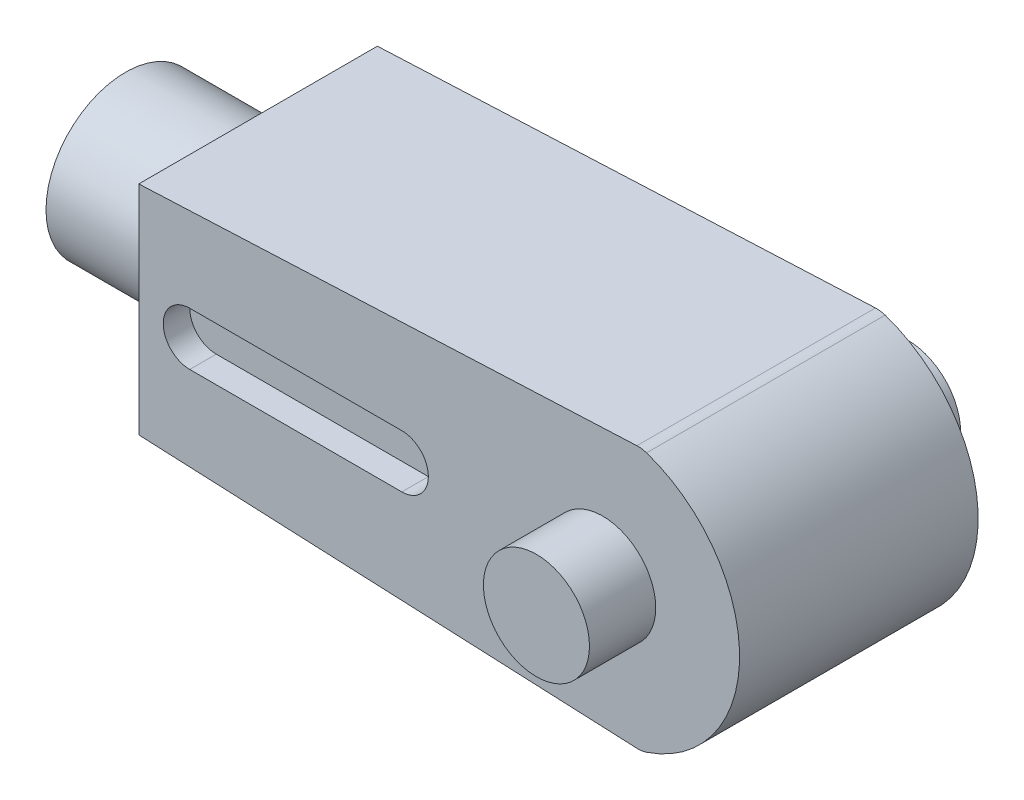
from build123d import *

# Parameters (mm, degrees)
SKETCH2_R                = 20
BOSS_EXTRUDE1_DEPTH      = 45
SKETCH3_R                = 30
BOSS_EXTRUDE2_DEPTH      = 50
BOSS_EXTRUDE3_DEPTH      = 25
BOSS_EXTRUDE3_DEPTH_BACK = 115
SKETCH4_R                = 20
CUT_EXTRUDE1_DEPTH       = 10


with BuildPart() as part:
    # Sketch2 → Boss-Extrude1 (new, symmetric)
    with BuildSketch(Plane.XY):
        with BuildLine():
            Line((-80.985865724, 41), (-80.985865724, -41))
            Line((-80.985865724, -41), (106.905960483, -49.424273902))
            ThreePointArc((106.905960483, -49.424273902), (108.756170043, -49.335499296), (110.558264434, -48.906999406))
            ThreePointArc((110.558264434, -48.906999406), (145.643610678, 0), (110.558264434, 48.906999406))
            ThreePointArc((110.558264434, 48.906999406), (108.756170043, 49.335499296), (106.905960483, 49.424273902))
            Line((106.905960483, 49.424273902), (-80.985865724, 41))
        make_face()
        with Locations(Location((94.014134276, 0, 0), (0, 0, 180))):
            Circle(SKETCH2_R, mode=Mode.SUBTRACT)
    extrude(amount=BOSS_EXTRUDE1_DEPTH, both=True)

    # Sketch3 → Boss-Extrude2 (add)
    with BuildSketch(Plane.ZY.offset(80.985865724)):
        Circle(SKETCH3_R)
    extrude(amount=BOSS_EXTRUDE2_DEPTH)

    # Sketch4 → Boss-Extrude3 (add, two sides: drawn at the far end of the back side and taken through both)
    with BuildSketch(Plane.XY.offset(45).offset(-BOSS_EXTRUDE3_DEPTH_BACK)):
        with Locations((94.014134276, 0)):
            Circle(SKETCH4_R)
    extrude(amount=BOSS_EXTRUDE3_DEPTH + BOSS_EXTRUDE3_DEPTH_BACK)

    # Sketch5 → Cut-Extrude1 (cut)
    with BuildSketch(Plane.XY.offset(45)):
        with BuildLine():
            Line((-61.758305815, 10), (18.241694185, 10))
            ThreePointArc((18.241694185, 10), (28.241694185, 0), (18.241694185, -10))
            Line((18.241694185, -10), (-61.758305815, -10))
            ThreePointArc((-61.758305815, -10), (-71.758305815, 0), (-61.758305815, 10))
        make_face()
    cut_extrude1 = extrude(amount=-CUT_EXTRUDE1_DEPTH, mode=Mode.SUBTRACT)

    # Mirror1: Cut-Extrude1 across plane
    add(cut_extrude1.mirror(Plane.XY), mode=Mode.SUBTRACT)


solid = part.part
